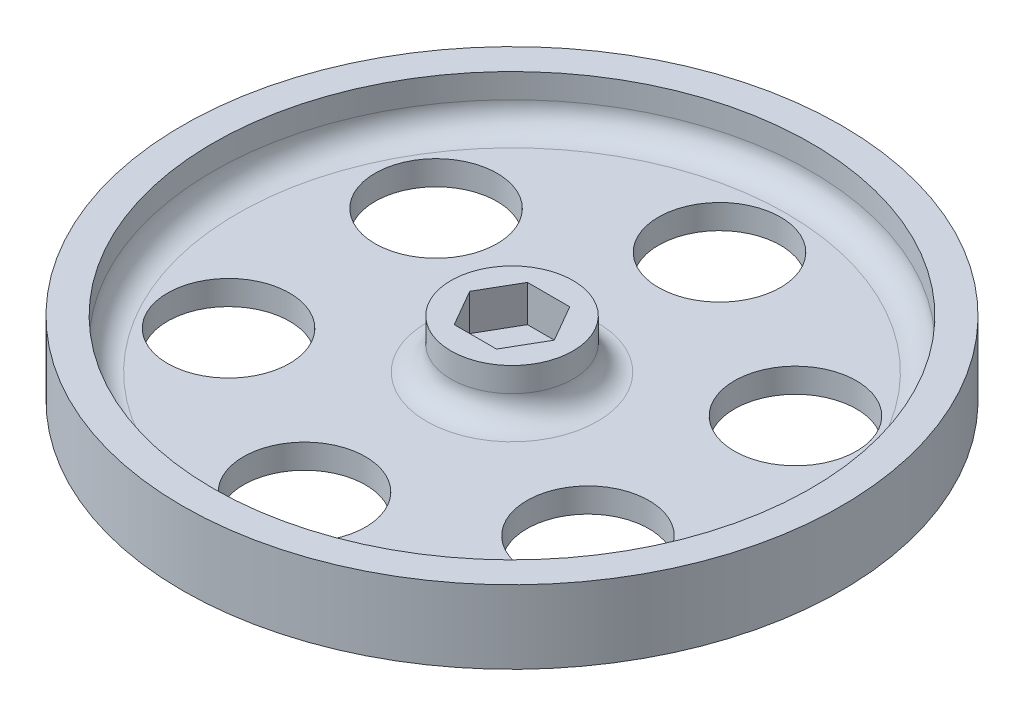
from build123d import *

# Parameters (mm, degrees)
SKETCH1_R           = 54
BOSS_EXTRUDE1_DEPTH = 6
SKETCH2_R           = 49
SKETCH2_R_2         = 10
CUT_EXTRUDE1_DEPTH  = 8
CUT_EXTRUDE2_DEPTH  = 6
SKETCH4_R           = 2
CUT_EXTRUDE3_DEPTH  = 6
SKETCH6_R           = 10
CUT_EXTRUDE5_DEPTH  = 4
FILLET1_R           = 4


with BuildPart() as part:
    # Sketch1 → Boss-Extrude1 (new, symmetric)
    with BuildSketch(Plane(origin=(0, 0, 0), x_dir=(1, 0, 0), z_dir=(0, 1, 0))):
        with Locations(Location((0, 0, 0), (0, 0, 270))):
            Circle(SKETCH1_R)
    extrude(amount=BOSS_EXTRUDE1_DEPTH, both=True)

    # Sketch2 → Cut-Extrude1 (cut)
    with BuildSketch(Plane(origin=(0, 6, 0), x_dir=(1, 0, 0), z_dir=(0, 1, 0))):
        with Locations(Location((0, 0, 0), (0, 0, 270))):
            Circle(SKETCH2_R)
        with Locations(Location((0, 0, 0), (0, 0, 270))):
            Circle(SKETCH2_R_2, mode=Mode.SUBTRACT)
    extrude(amount=-CUT_EXTRUDE1_DEPTH, mode=Mode.SUBTRACT)

    # Sketch3 → Cut-Extrude2 (cut)
    with BuildSketch(Plane(origin=(0, 6, 0), x_dir=(1, 0, 0), z_dir=(0, 1, 0))):
        Polygon((6.92820323, 0), (3.464101615, 6), (-3.464101615, 6), (-6.92820323, 0), (-3.464101615, -6), (3.464101615, -6), align=None)
    extrude(amount=-CUT_EXTRUDE2_DEPTH, mode=Mode.SUBTRACT)

    # Sketch4 → Cut-Extrude3 (cut)
    with BuildSketch(Plane(origin=(0, 0, 0), x_dir=(1, 0, 0), z_dir=(0, 1, 0))):
        with Locations(Location((0, 0, 0), (0, 0, 270))):
            Circle(SKETCH4_R)
    extrude(amount=-CUT_EXTRUDE3_DEPTH, mode=Mode.SUBTRACT)

    # Sketch6 → Cut-Extrude5 (cut)
    with BuildSketch(Plane(origin=(0, -2, 0), x_dir=(1, 0, 0), z_dir=(0, 1, 0))):
        with Locations(Location((0, 34, 0), (0, 0, 270))):
            Circle(SKETCH6_R)
        with Locations(Location((29.444863729, 17, 0), (0, 0, 270))):
            Circle(SKETCH6_R)
        with Locations(Location((29.444863729, -17, 0), (0, 0, 270))):
            Circle(SKETCH6_R)
        with Locations(Location((0, -34, 0), (0, 0, 270))):
            Circle(SKETCH6_R)
        with Locations(Location((-29.444863729, -17, 0), (0, 0, 270))):
            Circle(SKETCH6_R)
        with Locations(Location((-29.444863729, 17, 0), (0, 0, 270))):
            Circle(SKETCH6_R)
    extrude(amount=-CUT_EXTRUDE5_DEPTH, mode=Mode.SUBTRACT)

    # Fillet1
    fillet1_edges = [part.edges().sort_by_distance(p)[0] for p in [
        (0, -2, -49),
        (0, -2, -10),
    ]]
    fillet(fillet1_edges, radius=FILLET1_R)


solid = part.part
